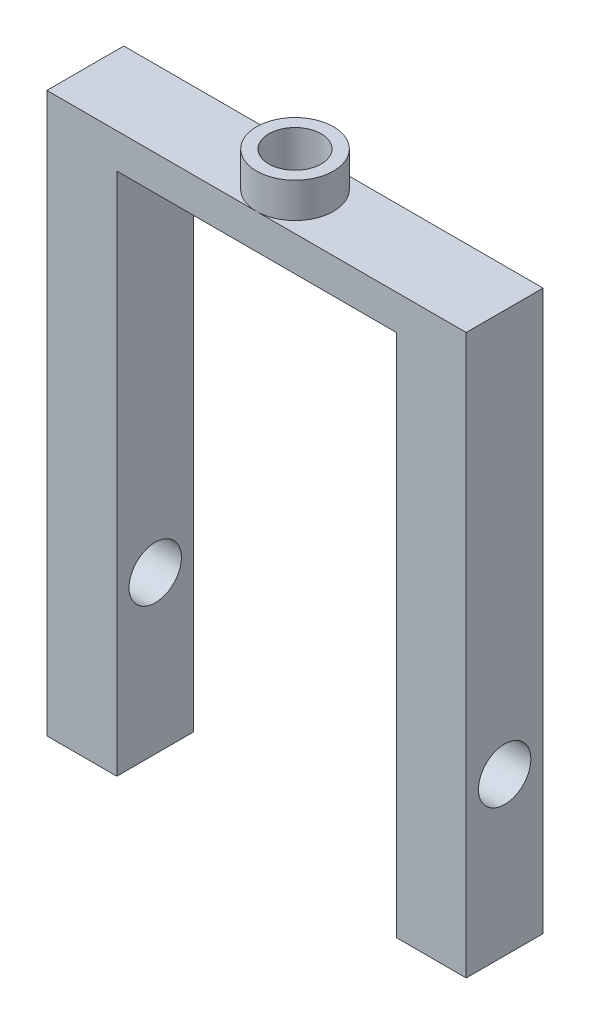
from build123d import *

# Parameters (mm, degrees)
SKETCH1_R               = 6.985
BOSS_EXTRUDE1_DEPTH     = 6.35
SKETCH3_R               = 4.7625
CUT_EXTRUDE1_DEPTH      = 63.5
SKETCH5_W               = 76.2
SKETCH5_H               = 13.97
BOSS_EXTRUDE2_DEPTH     = 101.6
SKETCH6_W               = 50.8
SKETCH6_H               = 95.25
CUT_EXTRUDE2_DEPTH      = 116.325510621
SKETCH7_R               = 4.7625
CUT_EXTRUDE3_DEPTH      = 115.689156964
CUT_EXTRUDE4_DEPTH      = 126.436209784
CUT_EXTRUDE4_DEPTH_BACK = 19.05
SKETCH8_R               = 4.7625


with BuildPart() as part:
    # Sketch1 → Boss-Extrude1 (new body)
    with BuildSketch(Plane(origin=(0, 0, 0), x_dir=(1, 0, 0), z_dir=(0, 1, 0))):
        with Locations(Location((0, 0, 0), (0, 0, 270))):
            Circle(SKETCH1_R)
    extrude(amount=-BOSS_EXTRUDE1_DEPTH)

    # Sketch3 → Cut-Extrude1 (cut)
    with BuildSketch(Plane(origin=(0, 0, 0), x_dir=(1, 0, 0), z_dir=(0, 1, 0))):
        with Locations(Location((0, 0, 0), (0, 0, 270))):
            Circle(SKETCH3_R)
    extrude(amount=-CUT_EXTRUDE1_DEPTH, mode=Mode.SUBTRACT)

    # Sketch5 → Boss-Extrude2 (add)
    with BuildSketch(Plane(origin=(0, -6.35, 0), x_dir=(-1, 0, 0), z_dir=(0, -1, 0))):
        Rectangle(SKETCH5_W, SKETCH5_H)
    extrude(amount=BOSS_EXTRUDE2_DEPTH)

    # Sketch6 → Cut-Extrude2 (cut, through all)
    with BuildSketch(Plane(origin=(0, 0, -6.985), x_dir=(-1, 0, 0), z_dir=(0, 0, -1))):
        with Locations((0, -60.325)):
            Rectangle(SKETCH6_W, SKETCH6_H)
    extrude(amount=-CUT_EXTRUDE2_DEPTH, mode=Mode.SUBTRACT)

    # Sketch7 → Cut-Extrude3 (cut, through all)
    with BuildSketch(Plane(origin=(0, 0, 0), x_dir=(1, 0, 0), z_dir=(0, 1, 0))):
        with Locations(Location((0, 0, 0), (0, 0, 270))):
            Circle(SKETCH7_R)
    extrude(amount=-CUT_EXTRUDE3_DEPTH, mode=Mode.SUBTRACT)

    # Sketch8 → Cut-Extrude4 (cut, two sides: drawn at the far end of the back side and taken through both)
    with BuildSketch(Plane.ZY.offset(-25.4).offset(-CUT_EXTRUDE4_DEPTH_BACK)):
        with Locations((0, -79.375)):
            Circle(SKETCH8_R)
    extrude(amount=CUT_EXTRUDE4_DEPTH + CUT_EXTRUDE4_DEPTH_BACK, mode=Mode.SUBTRACT)


solid = part.part
